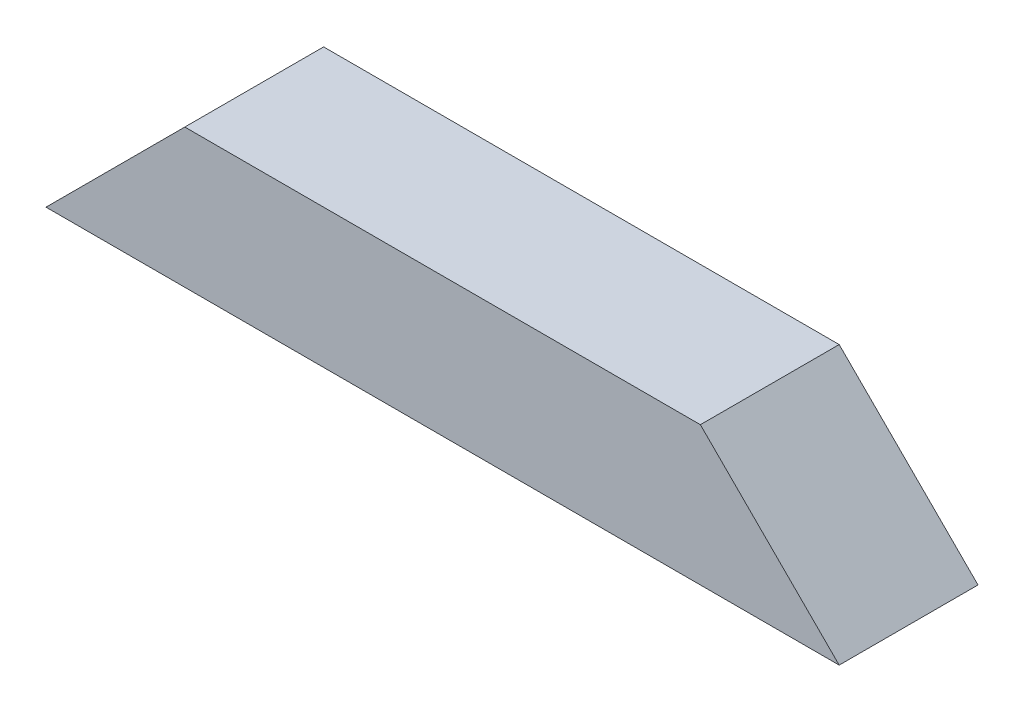
from build123d import *

# Parameters (mm, degrees)
BOSS_EXTRUDE1_DEPTH = 88.9


with BuildPart() as part:
    # Sketch1 → Boss-Extrude1 (new body)
    with BuildSketch(Plane.XY):
        Polygon((0, 0), (508, 0), (419.1, 88.9), (88.9, 88.9), align=None)
    extrude(amount=-BOSS_EXTRUDE1_DEPTH)


solid = part.part
